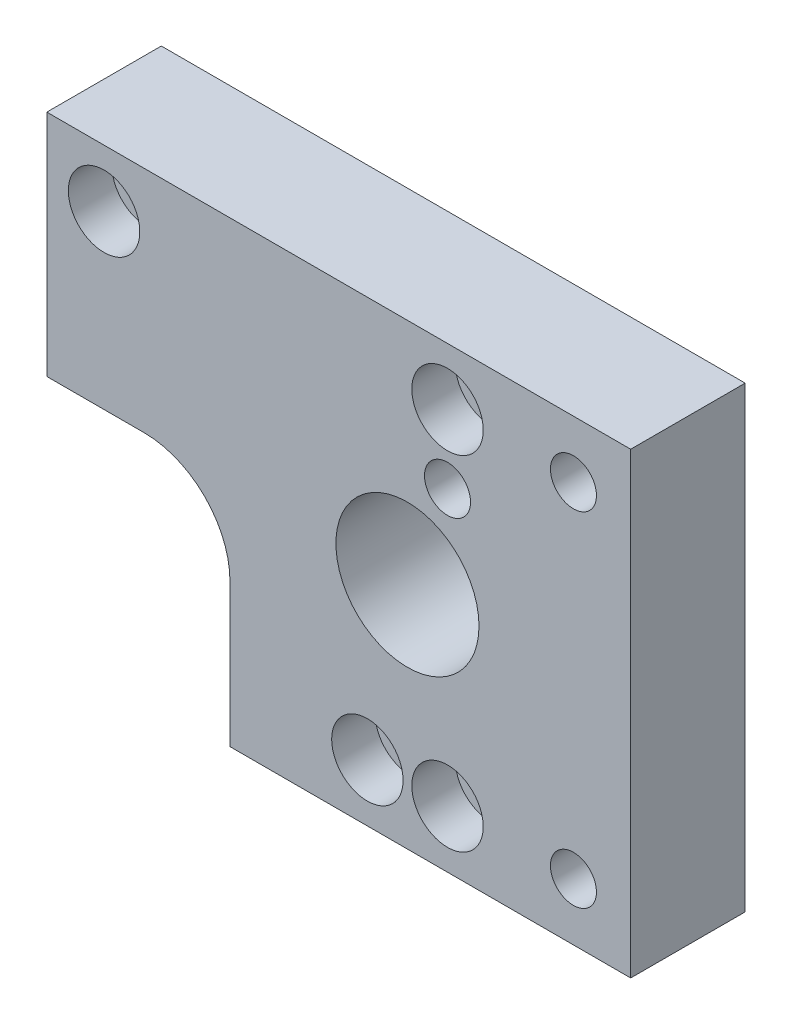
from build123d import *

# Parameters (mm, degrees)
SKETCH1_W                      = 64.77
SKETCH1_H                      = 50.8
SKETCH1_R                      = 2.5527
SKETCH1_R_2                    = 7.9375
BOSS_EXTRUDE1_DEPTH            = 12.7
F_7_0_201_DIAMETER_HOLE1_D     = 5.1054
F_7_0_201_DIAMETER_HOLE1_DEPTH = 70.104
F_7_0_201_DIAMETER_HOLE1_TIP   = 1.533816902
SKETCH6_R                      = 3.9624
CUT_EXTRUDE1_DEPTH             = 4.826
SKETCH7_W                      = 20.32
SKETCH7_H                      = 25.4
CUT_EXTRUDE2_DEPTH             = 49.543247728
FILLET2_R                      = 9.525


with BuildPart() as part:
    # Sketch1 → Boss-Extrude1 (new body)
    with BuildSketch(Plane.XY):
        with Locations((6.985, 0)):
            Rectangle(SKETCH1_W, SKETCH1_H)
        with Locations(Location((-19.05, 19.05, 0), (0, 0, 180))):
            Circle(SKETCH1_R, mode=Mode.SUBTRACT)
        with Locations((19.05, 19.05)):
            Circle(SKETCH1_R, mode=Mode.SUBTRACT)
        with Locations((19.05, -19.05)):
            Circle(SKETCH1_R, mode=Mode.SUBTRACT)
        with Locations((10.16, -19.05)):
            Circle(SKETCH1_R, mode=Mode.SUBTRACT)
        with Locations((14.605, 0)):
            Circle(SKETCH1_R_2, mode=Mode.SUBTRACT)
    extrude(amount=BOSS_EXTRUDE1_DEPTH)

    # #7 (0.201) Diameter Hole1
    with Locations(Plane(origin=(-24.721209515, -12.864288698, 0), x_dir=(1, 0, 0), z_dir=(0, 0, -1))):
        with Locations((57.741209515, 6.185711302), (57.741209515, -31.914288698), (43.771209515, -24.294288698)):
            Hole(F_7_0_201_DIAMETER_HOLE1_D / 2, depth=F_7_0_201_DIAMETER_HOLE1_DEPTH)
            with Locations((0, 0, -(F_7_0_201_DIAMETER_HOLE1_DEPTH + F_7_0_201_DIAMETER_HOLE1_TIP / 2))):  # 118° drill point
                Cone(0, F_7_0_201_DIAMETER_HOLE1_D / 2, F_7_0_201_DIAMETER_HOLE1_TIP, mode=Mode.SUBTRACT)

    # Sketch6 → Cut-Extrude1 (cut)
    with BuildSketch(Plane(origin=(0, 0, 12.7), x_dir=(-1, 0, 0), z_dir=(0, 0, -1))):
        with Locations((-19.05, 19.05)):
            Circle(SKETCH6_R)
        with Locations((-19.05, -19.05)):
            Circle(SKETCH6_R)
        with Locations((-10.16, -19.05)):
            Circle(SKETCH6_R)
        with Locations((19.05, 19.05)):
            Circle(SKETCH6_R)
    extrude(amount=CUT_EXTRUDE1_DEPTH, mode=Mode.SUBTRACT)

    # Sketch7 → Cut-Extrude2 (cut, through all)
    with BuildSketch(Plane(origin=(0, 0, 0), x_dir=(-1, 0, 0), z_dir=(0, 0, -1))):
        with Locations((15.24, -12.7)):
            Rectangle(SKETCH7_W, SKETCH7_H)
    extrude(amount=-CUT_EXTRUDE2_DEPTH, mode=Mode.SUBTRACT)

    # Fillet2
    fillet2_edges = [part.edges().sort_by_distance(p)[0] for p in [
        (-5.08, 0, 6.35),
    ]]
    fillet(fillet2_edges, radius=FILLET2_R)


solid = part.part
